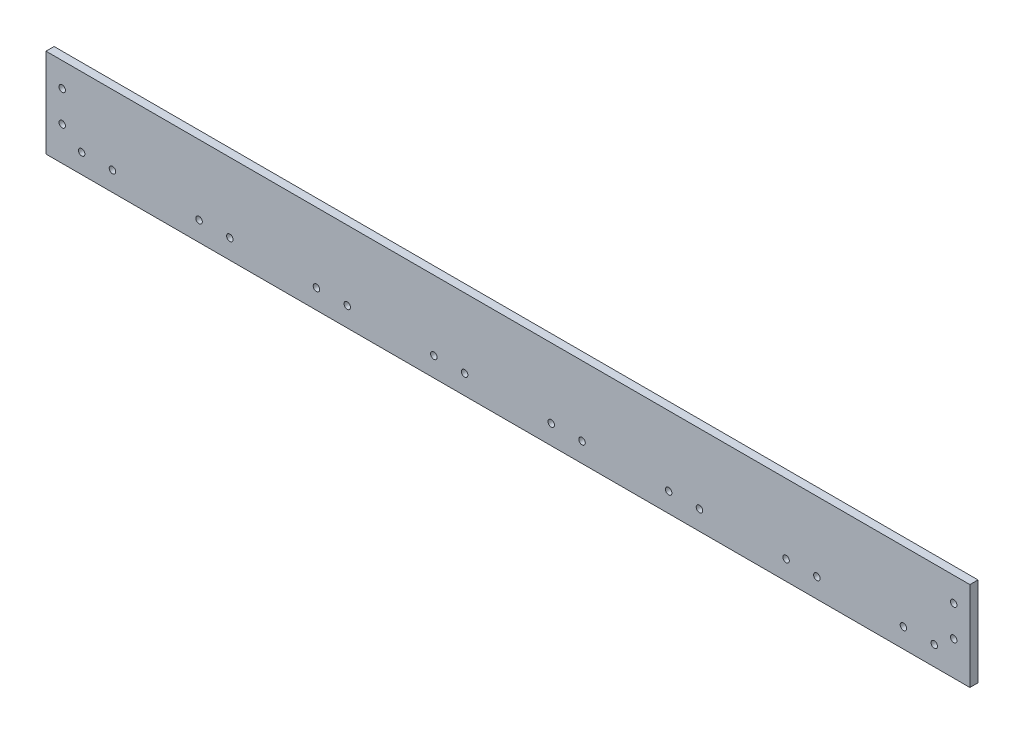
from build123d import *

# Parameters (mm, degrees)
SKETCH1_W           = 723.9
SKETCH1_H           = 69.85
BOSS_EXTRUDE1_DEPTH = 6.35
SKETCH2_R           = 2.54
CUT_EXTRUDE1_DEPTH  = 6.35
SKETCH3_R           = 2.54
CUT_EXTRUDE2_DEPTH  = 6.35
LPATTERN2_COUNT     = 8
LPATTERN2_PITCH     = 91.984285714


with BuildPart() as part:
    # Sketch1 → Boss-Extrude1 (new body)
    with BuildSketch(Plane.XY):
        with Locations((361.95, 34.925)):
            Rectangle(SKETCH1_W, SKETCH1_H)
    extrude(amount=BOSS_EXTRUDE1_DEPTH)

    # Sketch2 → Cut-Extrude1 (cut)
    with BuildSketch(Plane.XY.offset(6.35)):
        with Locations((27.94, 15.24)):
            Circle(SKETCH2_R)
        with Locations((52.07, 15.24)):
            Circle(SKETCH2_R)
    cut_extrude1 = extrude(amount=-CUT_EXTRUDE1_DEPTH, mode=Mode.SUBTRACT)

    # Sketch3 → Cut-Extrude2 (cut)
    with BuildSketch(Plane.XY.offset(6.35)):
        with Locations((12.7, 26.67)):
            Circle(SKETCH3_R)
        with Locations((12.7, 50.8)):
            Circle(SKETCH3_R)
        with Locations(Location((711.2, 26.67, 0), (0, 0, 180))):
            Circle(SKETCH3_R)
        with Locations(Location((711.2, 50.8, 0), (0, 0, 180))):
            Circle(SKETCH3_R)
    extrude(amount=-CUT_EXTRUDE2_DEPTH, mode=Mode.SUBTRACT)

    # LPattern2: Cut-Extrude1 ×8
    with Locations(*[(i * LPATTERN2_PITCH, 0, 0) for i in range(1, LPATTERN2_COUNT)]):
        add(cut_extrude1, mode=Mode.SUBTRACT)


solid = part.part
